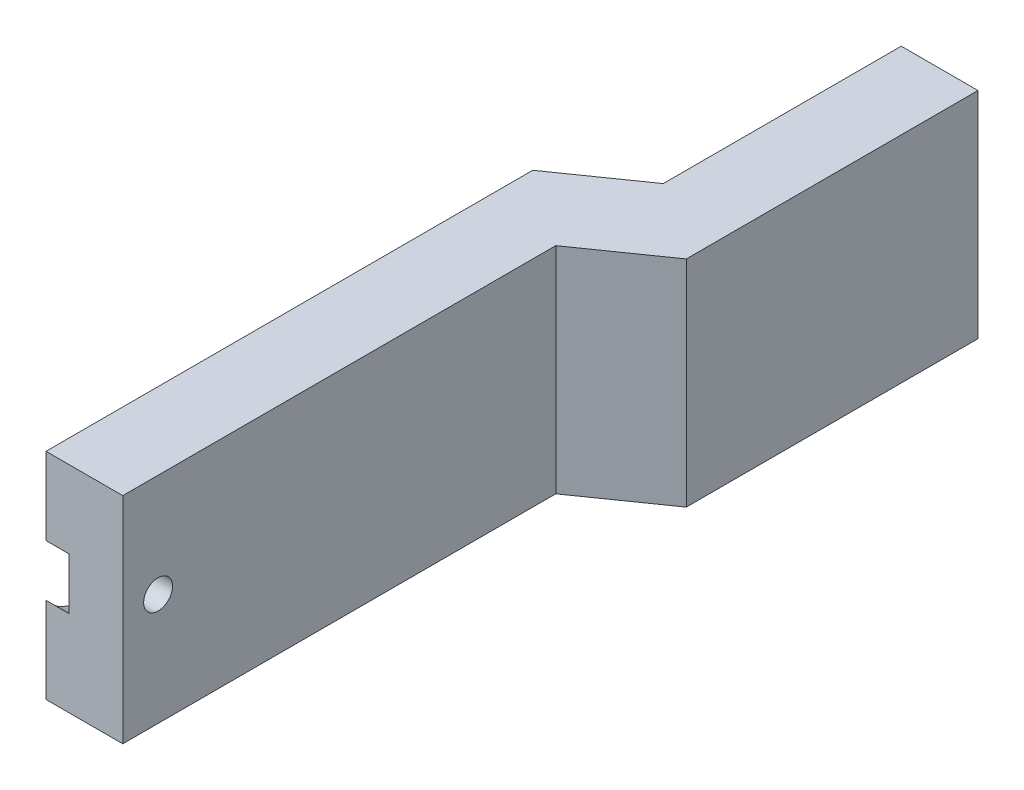
from build123d import *

# Parameters (mm, degrees)
SALIENTE_EXTRUIR1_DEPTH = 14
CROQUIS3_R              = 1
CORTAR_EXTRUIR1_DEPTH   = 5
CROQUIS5_R              = 2.85
CORTAR_EXTRUIR2_DEPTH   = 1.5
CROQUIS6_R              = 0.94
CORTAR_EXTRUIR3_DEPTH   = 54.279827327


with BuildPart() as part:
    # Croquis1 → Saliente-Extruir1 (new body)
    with BuildSketch(Plane(origin=(0, 0, 0), x_dir=(1, 0, 0), z_dir=(0, 1, 0))):
        Polygon((0, 0), (5, 0), (5, 28.2), (10, 31.7), (10, 50.7), (5, 50.7), (5, 35.2), (0, 31.7), align=None)
    extrude(amount=SALIENTE_EXTRUIR1_DEPTH)

    # Croquis3 → Cortar-Extruir1 (cut)
    with BuildSketch(Plane.XZ):
        with Locations(Location((2.5, -4.7, 0), (0, 0, 270))):
            Circle(CROQUIS3_R)
        with Locations(Location((7.5, -46, 0), (0, 0, 270))):
            Circle(CROQUIS3_R)
    extrude(amount=-CORTAR_EXTRUIR1_DEPTH, mode=Mode.SUBTRACT)

    # Croquis5 → Cortar-Extruir2 (cut)
    with BuildSketch(Plane.ZY):
        with Locations((-2.3, 7.28)):
            Circle(CROQUIS5_R)
    extrude(amount=-CORTAR_EXTRUIR2_DEPTH, mode=Mode.SUBTRACT)

    # Croquis6 → Cortar-Extruir3 (cut, through all)
    with BuildSketch(Plane.ZY.offset(-1.5)):
        with Locations((-2.3, 7.28)):
            Circle(CROQUIS6_R)
    extrude(amount=-CORTAR_EXTRUIR3_DEPTH, mode=Mode.SUBTRACT)


solid = part.part
